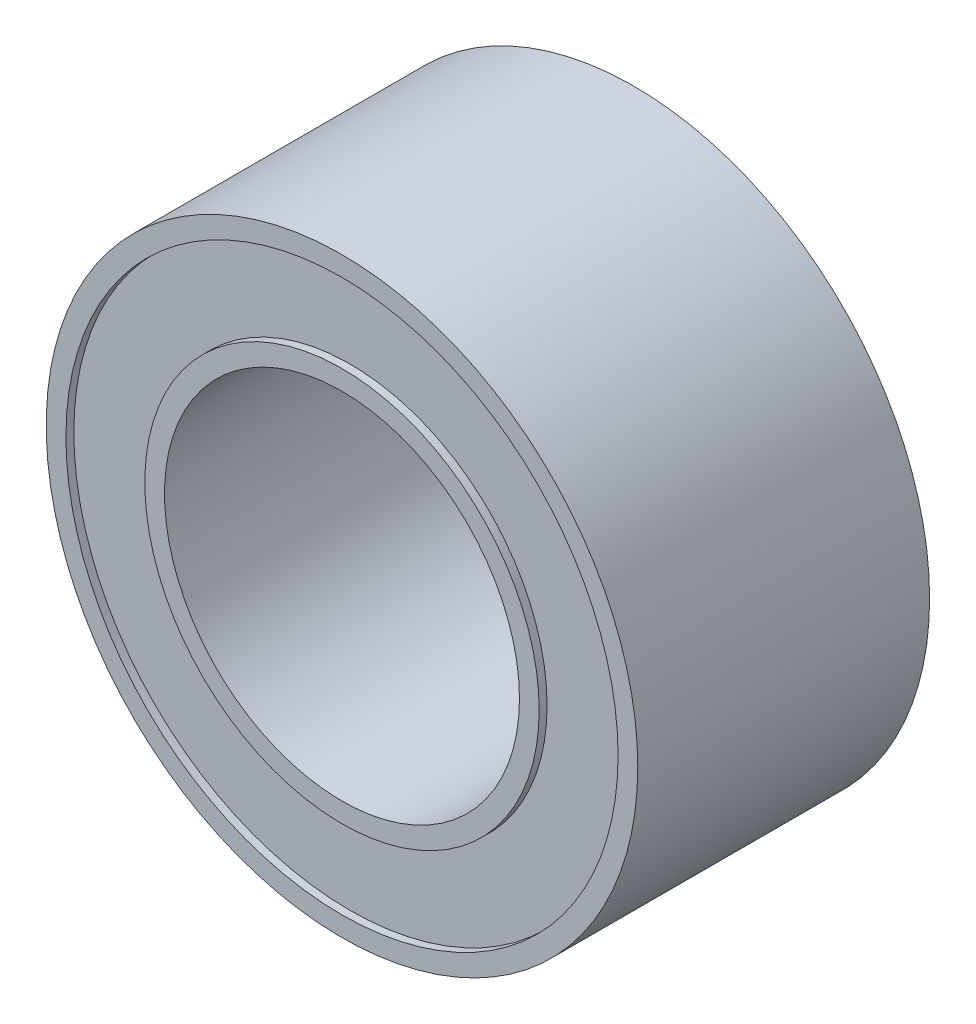
from build123d import *

# Parameters (mm, degrees)
SZKIC1_R                    = 37.5
SZKIC1_R_2                  = 22.5
DODANIE_WYCI_GNI_CIE1_DEPTH = 37
SZKIC2_R                    = 35
SZKIC2_R_2                  = 25
WYTNIJ_WYCI_GNI_CIE1_DEPTH  = 1


with BuildPart() as part:
    # Szkic1 → Dodanie-wyciągnięcie1 (new body)
    with BuildSketch(Plane.XY):
        Circle(SZKIC1_R)
        Circle(SZKIC1_R_2, mode=Mode.SUBTRACT)
    extrude(amount=DODANIE_WYCI_GNI_CIE1_DEPTH)

    # Szkic2 → Wytnij-wyciągnięcie1 (cut)
    with BuildSketch(Plane.XY.offset(37)):
        Circle(SZKIC2_R)
        Circle(SZKIC2_R_2, mode=Mode.SUBTRACT)
    wytnij_wyci_gni_cie1 = extrude(amount=-WYTNIJ_WYCI_GNI_CIE1_DEPTH, mode=Mode.SUBTRACT)

    # Lustro1: Wytnij-wyciągnięcie1 across plane
    add(wytnij_wyci_gni_cie1.mirror(Plane.XY.offset(18.5)), mode=Mode.SUBTRACT)


solid = part.part
